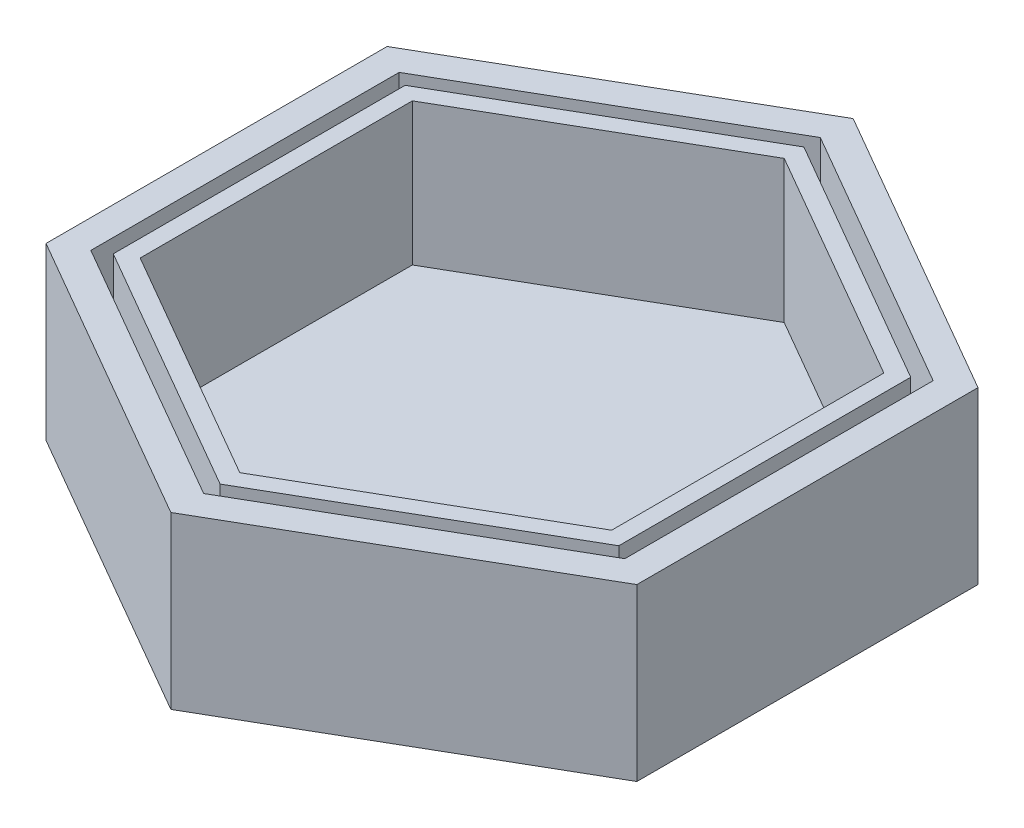
from build123d import *

# Parameters (mm, degrees)
BOSS_EXTRUDE1_DEPTH = 5
BOSS_EXTRUDE2_DEPTH = 25
BOSS_EXTRUDE4_DEPTH = 25
CUT_EXTRUDE1_DEPTH  = 3


with BuildPart() as part:
    # layout → Boss-Extrude1 (new body)
    with BuildSketch(Plane(origin=(0, 0, 0), x_dir=(1, 0, 0), z_dir=(0, 1, 0))):
        Polygon((0, -60), (51.961524227, -30), (51.961524227, 30), (0, 60), (-51.961524227, 30), (-51.961524227, -30), align=None)
    extrude(amount=BOSS_EXTRUDE1_DEPTH)

    # Sketch2 → Boss-Extrude2 (add)
    with BuildSketch(Plane(origin=(0, 5, 0), x_dir=(1, 0, 0), z_dir=(0, 1, 0))):
        Polygon((-51.961524227, -30), (0, -60), (51.961524227, -30), (51.961524227, 30), (0, 60), (-51.961524227, 30), align=None)
        Polygon((-46.961524227, -27.113248654), (0, -54.226497308), (46.961524227, -27.113248654), (46.961524227, 27.113248654), (0, 54.226497308), (-46.961524227, 27.113248654), align=None, mode=Mode.SUBTRACT)
    extrude(amount=BOSS_EXTRUDE2_DEPTH)

    # Sketch3 → Boss-Extrude4 (add)
    with BuildSketch(Plane(origin=(0, 5, 0), x_dir=(1, 0, 0), z_dir=(0, 1, 0))):
        Polygon((-44.461524227, 25.669872981), (-44.461524227, -25.669872981), (0, -51.339745962), (44.461524227, -25.669872981), (44.461524227, 25.669872981), (0, 51.339745962), align=None)
        Polygon((0, 47.875644347), (-41.461524227, 23.937822174), (-41.461524227, -23.937822174), (0, -47.875644347), (41.461524227, -23.937822174), (41.461524227, 23.937822174), align=None, mode=Mode.SUBTRACT)
    extrude(amount=BOSS_EXTRUDE4_DEPTH)

    # Sketch4 → Cut-Extrude1 (cut)
    with BuildSketch(Plane.ZY.offset(-41.461524227)):
        Polygon((-5, 5), (5, 5), (0, 10), align=None)
    extrude(amount=-CUT_EXTRUDE1_DEPTH, mode=Mode.SUBTRACT)


solid = part.part
